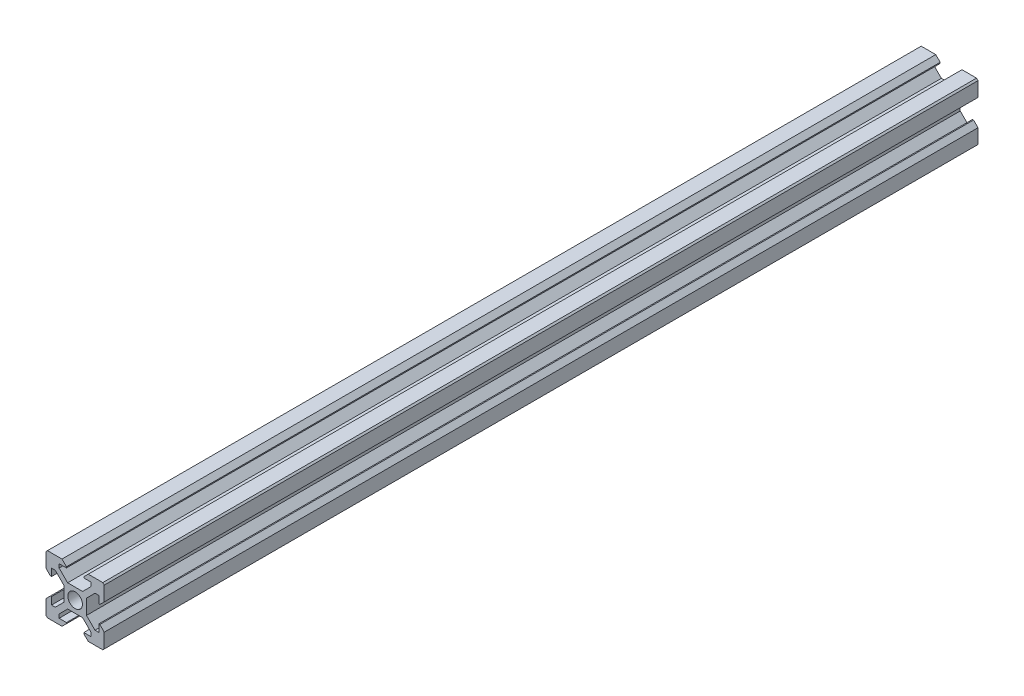
from build123d import *

# Parameters (mm, degrees)
BOSS_EXTRUDE1_DEPTH = 300
CHAMFER2_SIZE       = 0.5
CHAMFER2_SIZE2      = 0.353553391
CHAMFER1_SIZE       = 0.5


with BuildPart() as part:
    # Sketch1 → Boss-Extrude1 (new body)
    with BuildSketch(Plane.XY):
        with BuildLine():
            Line((5.5, 6.829360749), (2.570639251, 3.9))
            Line((2.570639251, 3.9), (0, 3.9))
            Line((0, 3.9), (0, 2.5))
            ThreePointArc((0, 2.5), (0.956708581, 2.309698831), (1.767766953, 1.767766953))
            Line((1.767766953, 1.767766953), (10, 10))
            Line((10, 10), (4.5, 10))
            Line((4.5, 10), (2.62, 8.12))
            Line((2.62, 8.12), (5.5, 8.12))
            Line((5.5, 8.12), (5.5, 6.829360749))
        make_face()
    extrude(amount=BOSS_EXTRUDE1_DEPTH)

    # Chamfer2
    chamfer2_edges = [part.edges().sort_by_distance(p)[0] for p in [
        (2.62, 8.12, 150),
    ]]
    chamfer2_side = [part.faces().sort_by_distance(p)[0] for p in [
        (3.56, 9.06, 150),
    ]]
    chamfer(chamfer2_edges, length=CHAMFER2_SIZE, length2=CHAMFER2_SIZE2, reference=chamfer2_side[0])

    # Mirror1: part across plane


with BuildPart() as part_1:
    add(part.part)
    add(part.part.mirror(Plane(origin=(10, 10, 300), x_dir=(0, 0, 1), z_dir=(-0.707106781186544, 0.707106781186551, 0))))

    # Chamfer1
    chamfer1_edges = [part_1.edges().sort_by_distance(p)[0] for p in [
        (10, 10, 150),
    ]]
    chamfer(chamfer1_edges, length=CHAMFER1_SIZE)

    # Mirror4: part across plane


with BuildPart() as part_2:
    add(part_1.part)
    add(part_1.part.mirror(Plane(origin=(0, 3.9, 300), x_dir=(0, 0, 1), z_dir=(1, 0, 0))))

    # Mirror5: part across plane


with BuildPart() as part_3:
    add(part_2.part)
    add(part_2.part.mirror(Plane(origin=(-3.9, 0, 300), x_dir=(0, 0, 1), z_dir=(0, 1, 0))))


solid = part_3.part
